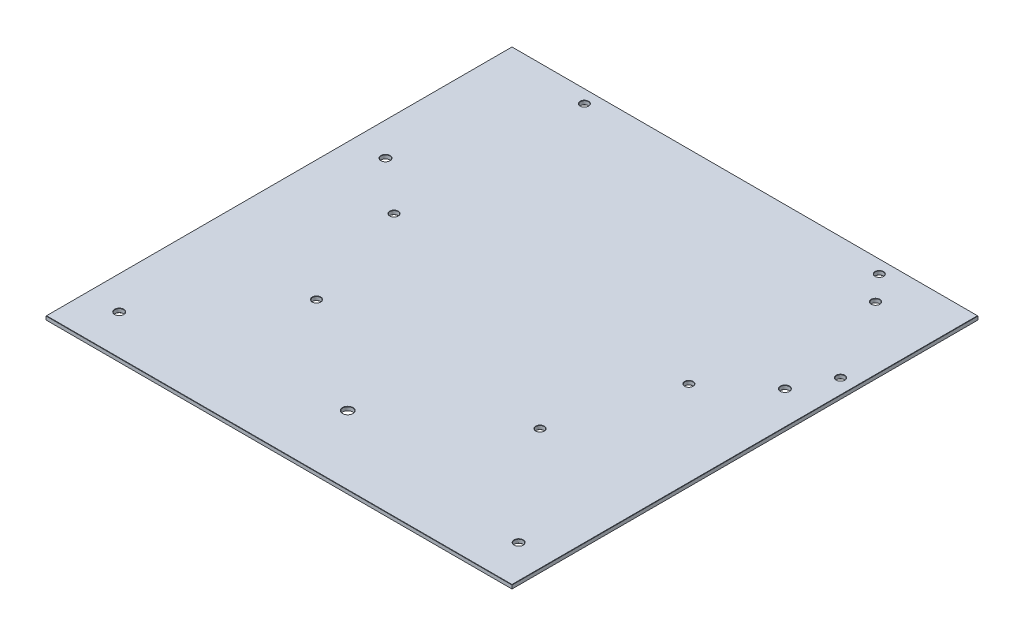
from build123d import *

# Parameters (mm, degrees)
SKETCH1_W           = 350
SKETCH1_H           = 350
BOSS_EXTRUDE1_DEPTH = 3
SKETCH2_R           = 3.75
SKETCH2_R_2         = 3.25
CUT_EXTRUDE1_DEPTH  = 3
SKETCH3_R           = 3.05
CUT_EXTRUDE2_DEPTH  = 3
SKETCH4_R           = 3
CUT_EXTRUDE3_DEPTH  = 3
SKETCH5_R           = 3.05
CUT_EXTRUDE4_DEPTH  = 3
CHAMFER1_SIZE       = 0.2


with BuildPart() as part:
    # Sketch1 → Boss-Extrude1 (new body)
    with BuildSketch(Plane(origin=(0, 0, 0), x_dir=(1, 0, 0), z_dir=(0, 1, 0))):
        Rectangle(SKETCH1_W, SKETCH1_H)
    extrude(amount=BOSS_EXTRUDE1_DEPTH)

    # Sketch2 → Cut-Extrude1 (cut)
    with BuildSketch(Plane(origin=(0, 3, 0), x_dir=(1, 0, 0), z_dir=(0, 1, 0))):
        with Locations(Location((0, -123.375, 0), (0, 0, 270))):
            Circle(SKETCH2_R)
        with Locations(Location((-150, -145, 0), (0, 0, 270))):
            Circle(SKETCH2_R_2)
        with Locations(Location((-150, 55, 0), (0, 0, 270))):
            Circle(SKETCH2_R_2)
        with Locations(Location((150, 55, 0), (0, 0, 270))):
            Circle(SKETCH2_R_2)
        with Locations(Location((150, -145, 0), (0, 0, 270))):
            Circle(SKETCH2_R_2)
    extrude(amount=-CUT_EXTRUDE1_DEPTH, mode=Mode.SUBTRACT)

    # Sketch3 → Cut-Extrude2 (cut)
    with BuildSketch(Plane(origin=(0, 3, 0), x_dir=(1, 0, 0), z_dir=(0, 1, 0))):
        with Locations(Location((-83.95, -62.901554786, 0), (0, 0, 270))):
            Circle(SKETCH3_R)
        with Locations(Location((83.95, -62.901554786, 0), (0, 0, 270))):
            Circle(SKETCH3_R)
    extrude(amount=-CUT_EXTRUDE2_DEPTH, mode=Mode.SUBTRACT)

    # Sketch4 → Cut-Extrude3 (cut)
    with BuildSketch(Plane(origin=(0, 3, 0), x_dir=(1, 0, 0), z_dir=(0, 1, 0))):
        with Locations(Location((-110.733018977, 165.110788036, 0), (0, 0, 270))):
            Circle(SKETCH4_R)
        with Locations(Location((-110.75, 22.110789044, 0), (0, 0, 270))):
            Circle(SKETCH4_R)
        with Locations(Location((110.749998438, 22.084486271, 0), (0, 0, 270))):
            Circle(SKETCH4_R)
        with Locations(Location((110.766979461, 165.084485263, 0), (0, 0, 270))):
            Circle(SKETCH4_R)
    extrude(amount=-CUT_EXTRUDE3_DEPTH, mode=Mode.SUBTRACT)

    # Sketch5 → Cut-Extrude4 (cut)
    with BuildSketch(Plane(origin=(0, 3, 0), x_dir=(1, 0, 0), z_dir=(0, 1, 0))):
        with Locations(Location((163.707635241, 83.030683972, 0), (0, 0, 270))):
            Circle(SKETCH5_R)
        with Locations(Location((127.458388125, 145.580683972, 0), (0, 0, 270))):
            Circle(SKETCH5_R)
    extrude(amount=-CUT_EXTRUDE4_DEPTH, mode=Mode.SUBTRACT)

    # Chamfer1
    chamfer1_edges = [part.edges().sort_by_distance(p)[0] for p in [
        (-175, 3, 0),
        (0, 3, 175),
        (150, 3, 141.75),
        (150, 0, 141.75),
        (150, 3, -58.25),
        (150, 0, -58.25),
        (-150, 3, -58.25),
        (-150, 0, -58.25),
        (-150, 3, 141.75),
        (-150, 0, 141.75),
        (0, 3, 119.625),
        (0, 0, 119.625),
        (-83.95, 3, 59.851554786),
        (-83.95, 0, 59.851554786),
        (83.95, 3, 59.851554786),
        (83.95, 0, 59.851554786),
        (175, 3, 0),
        (0, 0, 175),
        (-175, 0, 0),
        (110.766979461, 3, -168.084485263),
        (0, 0, -175),
        (110.766979461, 0, -168.084485263),
        (110.749998438, 3, -25.084486271),
        (110.749998438, 0, -25.084486271),
        (-110.75, 3, -25.110789044),
        (-110.75, 0, -25.110789044),
        (175, 0, 0),
        (-110.733018977, 3, -168.110788036),
        (-110.733018977, 0, -168.110788036),
        (163.707635241, 3, -86.080683972),
        (163.707635241, 0, -86.080683972),
        (127.458388125, 3, -148.630683972),
        (127.458388125, 0, -148.630683972),
        (0, 3, -175),
    ]]
    chamfer(chamfer1_edges, length=CHAMFER1_SIZE)


solid = part.part
